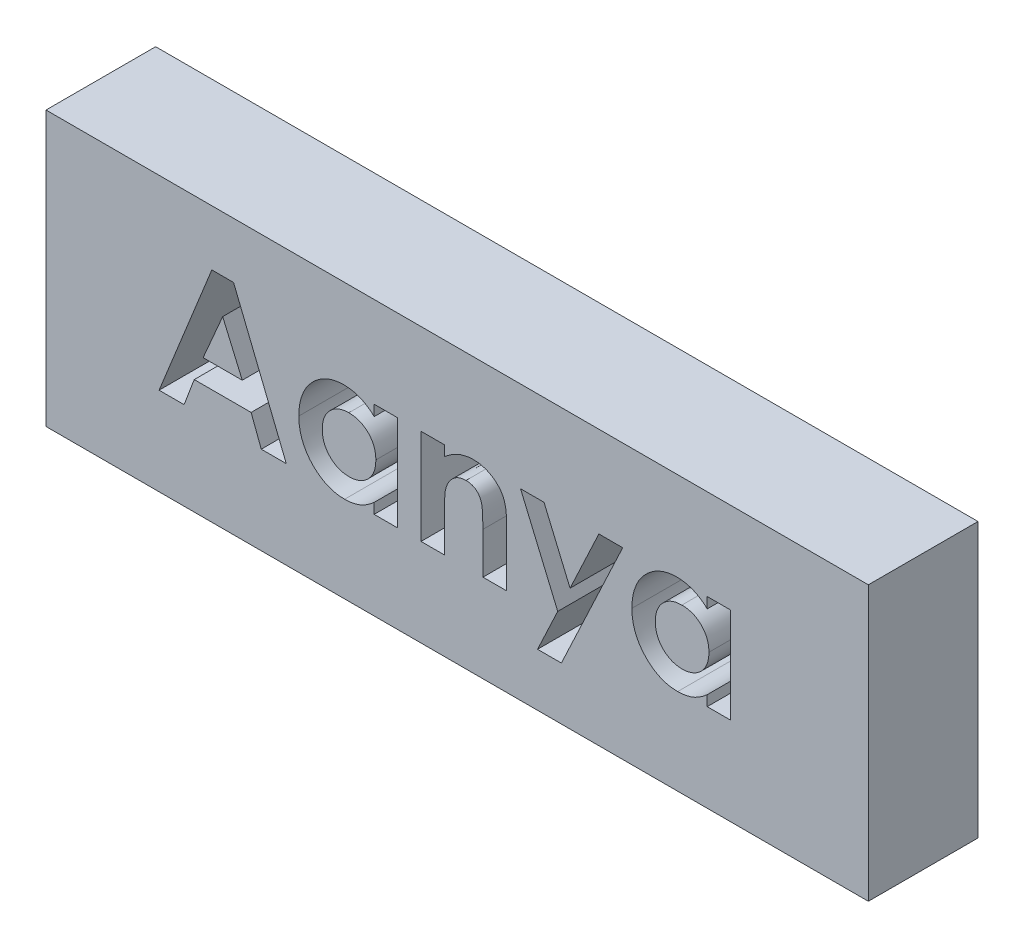
from build123d import *

# Parameters (mm, degrees)
SKETCH1_W             = 30
SKETCH1_H             = 10
BOSS_EXTRUDE1_DEPTH   = 4
BOSS_EXTRUDE1_2_DEPTH = 4
BOSS_EXTRUDE1_3_DEPTH = 4
BOSS_EXTRUDE1_4_DEPTH = 4


with BuildPart() as part:
    # Sketch1 → Boss-Extrude1 (new body)
    with BuildSketch(Plane.XY):
        Rectangle(SKETCH1_W, SKETCH1_H)
        Polygon((-8.950227386, 2.972800785), (-8.157431413, 2.972800785), (-6.234114105, -1.789699215), (-7.14711741, -1.789699215), (-7.51727967, -0.812776138), (-9.592287182, -0.812776138), (-9.962449441, -1.789699215), (-10.87449872, -1.789699215), align=None, mode=Mode.SUBTRACT)
        with BuildLine():
            Line((-3.028585259, 1.690589247), (-2.173777566, 1.690589247))
            Line((-2.173777566, 1.690589247), (-2.173777566, -1.789699215))
            Line((-2.173777566, -1.789699215), (-3.028585259, -1.789699215))
            Line((-3.028585259, -1.789699215), (-3.028585259, -1.409996691))
            add(Edge.make_bspline(
                [(-3.028585259, -1.409996691), (-3.109448543, -1.483031206), (-3.234126455, -1.583244659), (-3.412593084, -1.688515593), (-3.543477845, -1.749694875), (-3.677403568, -1.794800721), (-3.863696865, -1.839159605), (-4.008946987, -1.850101953), (-4.106635139, -1.850756907)],
                knots=[0, 0, 0, 0, 0.273943506, 0.399987178, 0.519718967, 0.636176176, 0.754371141, 1, 1, 1, 1], degree=3))
            add(Edge.make_bspline(
                [(-4.106635139, -1.850756907), (-4.216826962, -1.851939406), (-4.380188984, -1.835071091), (-4.590328363, -1.780938657), (-4.740744197, -1.724495935), (-4.885197774, -1.651242175), (-5.024795258, -1.56320685), (-5.157143319, -1.457266848), (-5.283343863, -1.338014799), (-5.398892017, -1.206836124), (-5.49990641, -1.065552185), (-5.585049993, -0.916166859), (-5.654818554, -0.759174501), (-5.709644482, -0.594693991), (-5.762819244, -0.361259877), (-5.775762749, -0.179109778), (-5.776181413, -0.056233169)],
                knots=[0, 0, 0, 0, 0.121092325, 0.179634237, 0.238303512, 0.297437091, 0.357506849, 0.419513154, 0.483600041, 0.548295031, 0.611486872, 0.674312645, 0.737107248, 0.800159515, 0.864737133, 1, 1, 1, 1], degree=3))
            add(Edge.make_bspline(
                [(-5.776181413, -0.056233169), (-5.775176048, 0.070341564), (-5.763751685, 0.257877811), (-5.71143136, 0.4978854), (-5.659114819, 0.665683147), (-5.591761783, 0.82454214), (-5.509744437, 0.974717685), (-5.411931694, 1.115818508), (-5.299220809, 1.245442767), (-5.177520506, 1.364249283), (-5.0473227, 1.467681181), (-4.910663602, 1.555546359), (-4.767396986, 1.627296749), (-4.617547075, 1.682674679), (-4.407383633, 1.737605648), (-4.242994424, 1.751752735), (-4.132393853, 1.751646939)],
                knots=[0, 0, 0, 0, 0.139308968, 0.205473642, 0.26959838, 0.332253223, 0.394830003, 0.45737553, 0.520581844, 0.583374035, 0.644082429, 0.703039519, 0.761664045, 0.819843943, 0.878346403, 1, 1, 1, 1], degree=3))
            add(Edge.make_bspline(
                [(-4.132393853, 1.751646939), (-4.029617531, 1.75284636), (-3.87724318, 1.737636457), (-3.680277724, 1.690153054), (-3.539162431, 1.640290756), (-3.402293036, 1.577169856), (-3.225809094, 1.470547315), (-3.10378304, 1.372262841), (-3.028585259, 1.298484379)],
                knots=[0, 0, 0, 0, 0.251537451, 0.373434128, 0.49566655, 0.617680221, 0.742091207, 1, 1, 1, 1], degree=3))
            Line((-3.028585259, 1.298484379), (-3.028585259, 1.690589247))
        make_face(mode=Mode.SUBTRACT)
        with BuildLine():
            Line((-1.318969874, 1.690589247), (-0.464162182, 1.690589247))
            Line((-0.464162182, 1.690589247), (-0.464162182, 1.32233504))
            add(Edge.make_bspline(
                [(-0.464162182, 1.32233504), (-0.372284149, 1.396427608), (-0.234413337, 1.494882211), (-0.046763752, 1.600819847), (0.081977273, 1.658403575), (0.20819473, 1.699742057), (0.375441967, 1.739587939), (0.503640723, 1.752165486), (0.58908301, 1.751646939)],
                knots=[0, 0, 0, 0, 0.30498931, 0.436681429, 0.556242249, 0.668759084, 0.77937854, 1, 1, 1, 1], degree=3))
            add(Edge.make_bspline(
                [(0.58908301, 1.751646939), (0.67389877, 1.750679465), (0.800369908, 1.742542434), (0.962053686, 1.702874319), (1.077375343, 1.664087921), (1.187264028, 1.612828663), (1.329794936, 1.53105809), (1.424694358, 1.450192155), (1.48491384, 1.392932997)],
                knots=[0, 0, 0, 0, 0.257369373, 0.381171348, 0.503298819, 0.625247689, 0.747811067, 1, 1, 1, 1], degree=3))
            add(Edge.make_bspline(
                [(1.48491384, 1.392932997), (1.536640647, 1.341642756), (1.605293207, 1.254576914), (1.676335975, 1.123422948), (1.720538071, 1.015066739), (1.753133786, 0.896726724), (1.78769193, 0.722708226), (1.794441929, 0.585654563), (1.794972434, 0.492332035)],
                knots=[0, 0, 0, 0, 0.223210024, 0.337545587, 0.456528166, 0.581243817, 0.713405156, 1, 1, 1, 1], degree=3))
            Line((1.794972434, 0.492332035), (1.794972434, -1.789699215))
            Line((1.794972434, -1.789699215), (0.940164741, -1.789699215))
            Line((0.940164741, -1.789699215), (0.940164741, -0.27852133))
            add(Edge.make_bspline(
                [(0.940164741, -0.27852133), (0.939921239, -0.184077615), (0.939080459, -0.048831759), (0.931783307, 0.122504308), (0.927051186, 0.231720565), (0.917756956, 0.327676198), (0.909375633, 0.410978362), (0.896515184, 0.480871387), (0.879781673, 0.556051871), (0.850560852, 0.636546034), (0.805196878, 0.721361146), (0.747646574, 0.793409386), (0.680259405, 0.853215359), (0.603113976, 0.900472865), (0.485188687, 0.946352258), (0.388504577, 0.958169957), (0.322909633, 0.957896939)],
                knots=[0, 0, 0, 0, 0.179518406, 0.256936513, 0.325929829, 0.387212867, 0.440139084, 0.484952067, 0.522188202, 0.586422033, 0.647003712, 0.704201966, 0.760716033, 0.817414001, 0.87521257, 1, 1, 1, 1], degree=3))
            add(Edge.make_bspline(
                [(0.322909633, 0.957896939), (0.236413259, 0.957004272), (0.106145203, 0.937950497), (-0.049350393, 0.861482108), (-0.153556015, 0.783390983), (-0.245518813, 0.686851638), (-0.349960397, 0.528819164), (-0.400837931, 0.392084047), (-0.424093071, 0.295802588)],
                knots=[0, 0, 0, 0, 0.240657962, 0.35738999, 0.477137096, 0.600008858, 0.725224946, 1, 1, 1, 1], degree=3))
            add(Edge.make_bspline(
                [(-0.424093071, 0.295802588), (-0.433082411, 0.261367741), (-0.439672028, 0.202869663), (-0.450244374, 0.117595667), (-0.453586585, 0.035974872), (-0.459280642, -0.05744191), (-0.46229677, -0.205693884), (-0.464104368, -0.322706873), (-0.464162182, -0.404452821)],
                knots=[0, 0, 0, 0, 0.151475868, 0.251213212, 0.366854146, 0.500124386, 0.650932297, 1, 1, 1, 1], degree=3))
            Line((-0.464162182, -0.404452821), (-0.464162182, -1.789699215))
            Line((-0.464162182, -1.789699215), (-1.318969874, -1.789699215))
            Line((-1.318969874, -1.789699215), (-1.318969874, 1.690589247))
        make_face(mode=Mode.SUBTRACT)
        Polygon((2.312054765, 1.690589247), (3.167816484, 1.690589247), (4.118026821, -0.548510813), (5.16936396, 1.690589247), (6.038482049, 1.690589247), (3.801290042, -3.071910753), (2.932171953, -3.071910753), (3.66772634, -1.506353361), align=None, mode=Mode.SUBTRACT)
        with BuildLine():
            Line((9.12189551, 1.690589247), (9.976703203, 1.690589247))
            Line((9.976703203, 1.690589247), (9.976703203, -1.789699215))
            Line((9.976703203, -1.789699215), (9.12189551, -1.789699215))
            Line((9.12189551, -1.789699215), (9.12189551, -1.409996691))
            add(Edge.make_bspline(
                [(9.12189551, -1.409996691), (9.041032226, -1.483031206), (8.916354315, -1.583244659), (8.737887685, -1.688515593), (8.607002924, -1.749694875), (8.473077201, -1.794800721), (8.286783904, -1.839159605), (8.141533782, -1.850101953), (8.043845631, -1.850756907)],
                knots=[0, 0, 0, 0, 0.273943506, 0.399987178, 0.519718967, 0.636176176, 0.754371141, 1, 1, 1, 1], degree=3))
            add(Edge.make_bspline(
                [(8.043845631, -1.850756907), (7.933653807, -1.851939406), (7.770291785, -1.835071091), (7.560152406, -1.780938657), (7.409736572, -1.724495935), (7.265282995, -1.651242175), (7.125685512, -1.56320685), (6.99333745, -1.457266848), (6.867136906, -1.338014799), (6.751588752, -1.206836124), (6.650574359, -1.065552185), (6.565430776, -0.916166859), (6.495662215, -0.759174501), (6.440836287, -0.594693991), (6.387661525, -0.361259877), (6.37471802, -0.179109778), (6.374299357, -0.056233169)],
                knots=[0, 0, 0, 0, 0.121092325, 0.179634237, 0.238303512, 0.297437091, 0.357506849, 0.419513154, 0.483600041, 0.548295031, 0.611486872, 0.674312645, 0.737107248, 0.800159515, 0.864737133, 1, 1, 1, 1], degree=3))
            add(Edge.make_bspline(
                [(6.374299357, -0.056233169), (6.375304721, 0.070341564), (6.386729085, 0.257877811), (6.439049409, 0.4978854), (6.49136595, 0.665683147), (6.558718986, 0.82454214), (6.640736332, 0.974717685), (6.738549075, 1.115818508), (6.85125996, 1.245442767), (6.972960263, 1.364249283), (7.103158069, 1.467681181), (7.239817167, 1.555546359), (7.383083783, 1.627296749), (7.532933695, 1.682674679), (7.743097136, 1.737605648), (7.907486345, 1.751752735), (8.018086917, 1.751646939)],
                knots=[0, 0, 0, 0, 0.139308968, 0.205473642, 0.26959838, 0.332253223, 0.394830003, 0.45737553, 0.520581844, 0.583374035, 0.644082429, 0.703039519, 0.761664045, 0.819843943, 0.878346403, 1, 1, 1, 1], degree=3))
            add(Edge.make_bspline(
                [(8.018086917, 1.751646939), (8.120863238, 1.75284636), (8.273237589, 1.737636457), (8.470203045, 1.690153054), (8.611318339, 1.640290756), (8.748187733, 1.577169856), (8.924671676, 1.470547315), (9.04669773, 1.372262841), (9.12189551, 1.298484379)],
                knots=[0, 0, 0, 0, 0.251537451, 0.373434128, 0.49566655, 0.617680221, 0.742091207, 1, 1, 1, 1], degree=3))
            Line((9.12189551, 1.298484379), (9.12189551, 1.690589247))
        make_face(mode=Mode.SUBTRACT)
    extrude(amount=BOSS_EXTRUDE1_DEPTH)


with BuildPart() as body_2:
    # Sketch1 → Boss-Extrude1 2 (new body)
    with BuildSketch(Plane.XY):
        Polygon((-8.554306413, 1.695359379), (-9.267918191, 0.042031554), (-7.840694634, 0.042031554), align=None)
    extrude(amount=BOSS_EXTRUDE1_2_DEPTH)


with BuildPart() as body_3:
    # Sketch1 → Boss-Extrude1 3 (new body)
    with BuildSketch(Plane.XY):
        with BuildLine():
            add(Edge.make_bspline(
                [(-3.953036881, 0.957896939), (-4.019715924, 0.956847325), (-4.118766217, 0.950262908), (-4.245863706, 0.92075671), (-4.334671924, 0.888703368), (-4.419787219, 0.849629409), (-4.499914683, 0.800697564), (-4.575716269, 0.742859192), (-4.646746033, 0.677516741), (-4.711500064, 0.605693322), (-4.767322083, 0.52731837), (-4.81476079, 0.444503959), (-4.854885313, 0.356999758), (-4.88359161, 0.263775454), (-4.914487968, 0.131253669), (-4.919855257, 0.027174003), (-4.92137372, -0.042876799)],
                knots=[0, 0, 0, 0, 0.128420809, 0.189995948, 0.250359009, 0.30974405, 0.369855539, 0.430536995, 0.492876096, 0.555257199, 0.616197084, 0.67757746, 0.738630831, 0.800921896, 0.864881541, 1, 1, 1, 1], degree=3))
            add(Edge.make_bspline(
                [(-4.92137372, -0.042876799), (-4.920106261, -0.113645316), (-4.914006344, -0.218423763), (-4.884215883, -0.352792687), (-4.852242311, -0.446404394), (-4.813171733, -0.535729434), (-4.765620179, -0.620352595), (-4.70720978, -0.698778396), (-4.642399009, -0.772862518), (-4.569912067, -0.839016562), (-4.493681597, -0.897756049), (-4.412666306, -0.946900569), (-4.327745201, -0.986629663), (-4.239203983, -1.018967498), (-4.113293305, -1.048068944), (-4.015412547, -1.056716157), (-3.949220776, -1.057006907)],
                knots=[0, 0, 0, 0, 0.135364742, 0.199460916, 0.262263612, 0.323991109, 0.385461119, 0.447170687, 0.510418175, 0.573170928, 0.634270788, 0.693953647, 0.753722967, 0.813083582, 0.873628543, 1, 1, 1, 1], degree=3))
            add(Edge.make_bspline(
                [(-3.949220776, -1.057006907), (-3.881286874, -1.05587761), (-3.780629344, -1.049532988), (-3.651632641, -1.01988276), (-3.561631851, -0.987644291), (-3.475340372, -0.948851138), (-3.393539597, -0.900875373), (-3.317116482, -0.843169755), (-3.245684141, -0.777236598), (-3.180230251, -0.704826694), (-3.12363621, -0.625423999), (-3.074341962, -0.541568228), (-3.035569728, -0.451275823), (-3.004796673, -0.356129933), (-2.974696763, -0.219395659), (-2.968827934, -0.112348016), (-2.967527566, -0.04001472)],
                knots=[0, 0, 0, 0, 0.128661741, 0.189789734, 0.249707447, 0.309188905, 0.368499841, 0.428643518, 0.489936978, 0.552121002, 0.612878024, 0.674050383, 0.735729182, 0.798304624, 0.862952782, 1, 1, 1, 1], degree=3))
            add(Edge.make_bspline(
                [(-2.967527566, -0.04001472), (-2.968759837, 0.030726506), (-2.974681464, 0.13560595), (-3.005005958, 0.269692293), (-3.035144594, 0.363176707), (-3.07460668, 0.451317595), (-3.12393818, 0.533133903), (-3.179911435, 0.611461245), (-3.246089993, 0.681914951), (-3.317135364, 0.747370715), (-3.394682425, 0.803331236), (-3.476287737, 0.85155825), (-3.562453867, 0.891159355), (-3.653974172, 0.920170348), (-3.783365466, 0.950775684), (-3.884852353, 0.956651686), (-3.953036881, 0.957896939)],
                knots=[0, 0, 0, 0, 0.135095843, 0.199062931, 0.26154836, 0.322044302, 0.382646423, 0.443384787, 0.505154721, 0.566515904, 0.627254268, 0.687026267, 0.746970113, 0.807538884, 0.869732605, 1, 1, 1, 1], degree=3))
        make_face()
    extrude(amount=BOSS_EXTRUDE1_3_DEPTH)


with BuildPart() as body_4:
    # Sketch1 → Boss-Extrude1 4 (new body)
    with BuildSketch(Plane.XY):
        with BuildLine():
            add(Edge.make_bspline(
                [(8.197443888, 0.957896939), (8.130764846, 0.956847325), (8.031714553, 0.950262908), (7.904617064, 0.92075671), (7.815808845, 0.888703368), (7.73069355, 0.849629409), (7.650566087, 0.800697564), (7.5747645, 0.742859192), (7.503734736, 0.677516741), (7.438980705, 0.605693322), (7.383158686, 0.52731837), (7.335719979, 0.444503959), (7.295595457, 0.356999758), (7.26688916, 0.263775454), (7.235992801, 0.131253669), (7.230625512, 0.027174003), (7.229107049, -0.042876799)],
                knots=[0, 0, 0, 0, 0.128420809, 0.189995948, 0.250359009, 0.30974405, 0.369855539, 0.430536995, 0.492876096, 0.555257199, 0.616197084, 0.67757746, 0.738630831, 0.800921896, 0.864881541, 1, 1, 1, 1], degree=3))
            add(Edge.make_bspline(
                [(7.229107049, -0.042876799), (7.230374508, -0.113645316), (7.236474425, -0.218423763), (7.266264886, -0.352792687), (7.298238458, -0.446404394), (7.337309036, -0.535729434), (7.38486059, -0.620352595), (7.44327099, -0.698778396), (7.50808176, -0.772862518), (7.580568702, -0.839016562), (7.656799172, -0.897756049), (7.737814463, -0.946900569), (7.822735568, -0.986629663), (7.911276786, -1.018967498), (8.037187464, -1.048068944), (8.135068222, -1.056716157), (8.201259994, -1.057006907)],
                knots=[0, 0, 0, 0, 0.135364742, 0.199460916, 0.262263612, 0.323991109, 0.385461119, 0.447170687, 0.510418175, 0.573170928, 0.634270788, 0.693953647, 0.753722967, 0.813083582, 0.873628543, 1, 1, 1, 1], degree=3))
            add(Edge.make_bspline(
                [(8.201259994, -1.057006907), (8.269193895, -1.05587761), (8.369851425, -1.049532988), (8.498848128, -1.01988276), (8.588848919, -0.987644291), (8.675140398, -0.948851138), (8.756941172, -0.900875373), (8.833364287, -0.843169755), (8.904796628, -0.777236598), (8.970250519, -0.704826694), (9.026844559, -0.625423999), (9.076138807, -0.541568228), (9.114911041, -0.451275823), (9.145684096, -0.356129933), (9.175784007, -0.219395659), (9.181652835, -0.112348016), (9.182953203, -0.04001472)],
                knots=[0, 0, 0, 0, 0.128661741, 0.189789734, 0.249707447, 0.309188905, 0.368499841, 0.428643518, 0.489936978, 0.552121002, 0.612878024, 0.674050383, 0.735729182, 0.798304624, 0.862952782, 1, 1, 1, 1], degree=3))
            add(Edge.make_bspline(
                [(9.182953203, -0.04001472), (9.181720932, 0.030726506), (9.175799305, 0.13560595), (9.145474811, 0.269692293), (9.115336176, 0.363176707), (9.075874089, 0.451317595), (9.026542589, 0.533133903), (8.970569335, 0.611461245), (8.904390777, 0.681914951), (8.833345405, 0.747370715), (8.755798344, 0.803331236), (8.674193032, 0.85155825), (8.588026902, 0.891159355), (8.496506597, 0.920170348), (8.367115303, 0.950775684), (8.265628416, 0.956651686), (8.197443888, 0.957896939)],
                knots=[0, 0, 0, 0, 0.135095843, 0.199062931, 0.26154836, 0.322044302, 0.382646423, 0.443384787, 0.505154721, 0.566515904, 0.627254268, 0.687026267, 0.746970113, 0.807538884, 0.869732605, 1, 1, 1, 1], degree=3))
        make_face()
    extrude(amount=BOSS_EXTRUDE1_4_DEPTH)


solid = Compound([part.part, body_2.part, body_3.part, body_4.part])
